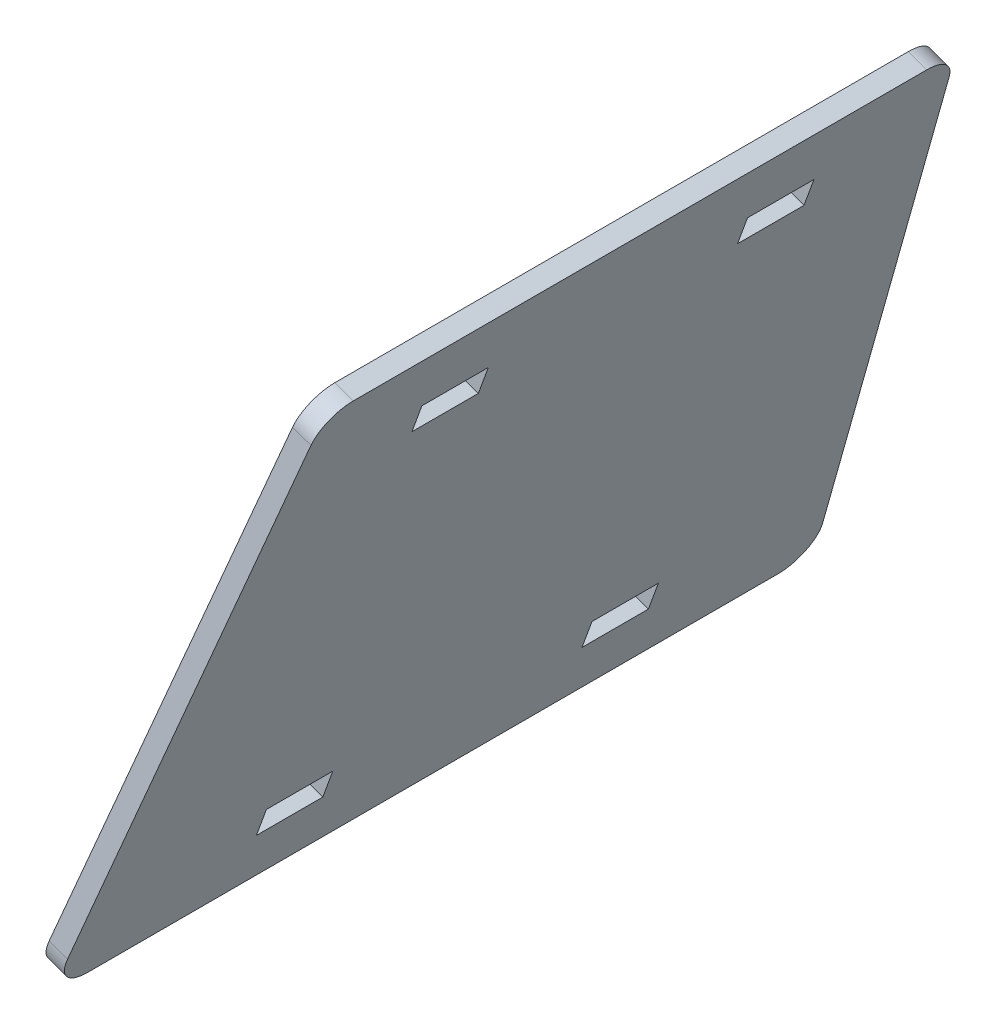
from build123d import *

# Parameters (mm, degrees)
BOSS_EXTRUDE1_DEPTH        = 58
SKETCH3_OUTSIDE_W          = 147.986
SKETCH3_OUTSIDE_H          = 126.948
TAB_AND_SLOT_CONTOUR_DEPTH = 3
MOUNTING_TAB_SLOTS_REACH   = 197.382
SKETCH4_W                  = 10.2
SKETCH4_H                  = 4.48444402


with BuildPart() as part:
    # Sketch1 → Boss-Extrude1 (new, symmetric)
    with BuildSketch(Plane.XY):
        Polygon((-63.840100917, 220.738237129), (-95.659428373, 133.315353441), (-98.478506236, 134.341413871), (-66.659178779, 221.764297559), align=None)
    extrude(amount=BOSS_EXTRUDE1_DEPTH, both=True)

    # Sketch3 outside → tab and slot contour (cut)
    with BuildSketch(Plane(origin=(-130.135207504, 47.365341962, 0), x_dir=(0, 0, 1), z_dir=(-0.9396926207859098, 0.3420201433256651, 0))):
        with Locations((0, 139.075)):
            Rectangle(SKETCH3_OUTSIDE_W, SKETCH3_OUTSIDE_H)
        with BuildLine():
            Line((-44.02892944, 185.59149209), (44.02892944, 185.59149209))
            ThreePointArc((44.02892944, 185.59149209), (47.369183029, 184.312070804), (49, 181.128574477))
            Line((49, 181.128574477), (57.97107056, 98.09508485))
            ThreePointArc((57.97107056, 98.09508485), (56.720578714, 94.217748875), (53, 92.558002463))
            Line((53, 92.558002463), (-53, 92.558002463))
            ThreePointArc((-53, 92.558002463), (-56.720578714, 94.217748875), (-57.97107056, 98.09508485))
            Line((-57.97107056, 98.09508485), (-49, 181.128574477))
            ThreePointArc((-49, 181.128574477), (-47.369183029, 184.312070804), (-44.02892944, 185.59149209))
        make_face(mode=Mode.SUBTRACT)
    extrude(amount=-TAB_AND_SLOT_CONTOUR_DEPTH, mode=Mode.SUBTRACT)

    # Sketch4 → mounting tab slots (cut, up to next)
    with BuildSketch(Plane(origin=(-130.135207504, 47.365341962, 0), x_dir=(0, 0, 1), z_dir=(-0.9396926207859099, 0.3420201433256647, 0)), mode=Mode.PRIVATE) as mounting_tab_slots_sk1:
        with Locations((-25, 173.44927008)):
            Rectangle(SKETCH4_W, SKETCH4_H)
    mounting_tab_slots_tool1 = extrude(mounting_tab_slots_sk1.sketch, amount=-MOUNTING_TAB_SLOTS_REACH, mode=Mode.PRIVATE) & part.part
    # Sketch4 → mounting tab slots (cut, up to next)
    with BuildSketch(Plane(origin=(-130.135207504, 47.365341962, 0), x_dir=(0, 0, 1), z_dir=(-0.9396926207859099, 0.3420201433256647, 0)), mode=Mode.PRIVATE) as mounting_tab_slots_sk2:
        with Locations((-25, 103.608313771)):
            Rectangle(SKETCH4_W, SKETCH4_H)
    mounting_tab_slots_tool2 = extrude(mounting_tab_slots_sk2.sketch, amount=-MOUNTING_TAB_SLOTS_REACH, mode=Mode.PRIVATE) & part.part
    # Sketch4 → mounting tab slots (cut, up to next)
    with BuildSketch(Plane(origin=(-130.135207504, 47.365341962, 0), x_dir=(0, 0, 1), z_dir=(-0.9396926207859099, 0.3420201433256647, 0)), mode=Mode.PRIVATE) as mounting_tab_slots_sk3:
        with Locations((25, 173.44927008)):
            Rectangle(SKETCH4_W, SKETCH4_H)
    mounting_tab_slots_tool3 = extrude(mounting_tab_slots_sk3.sketch, amount=-MOUNTING_TAB_SLOTS_REACH, mode=Mode.PRIVATE) & part.part
    # Sketch4 → mounting tab slots (cut, up to next)
    with BuildSketch(Plane(origin=(-130.135207504, 47.365341962, 0), x_dir=(0, 0, 1), z_dir=(-0.9396926207859099, 0.3420201433256647, 0)), mode=Mode.PRIVATE) as mounting_tab_slots_sk4:
        with Locations((25, 103.608313771)):
            Rectangle(SKETCH4_W, SKETCH4_H)
    mounting_tab_slots_tool4 = extrude(mounting_tab_slots_sk4.sketch, amount=-MOUNTING_TAB_SLOTS_REACH, mode=Mode.PRIVATE) & part.part
    add(mounting_tab_slots_tool1.solids().sort_by_distance((-70.812063, 210.354341, -25))[0], mode=Mode.SUBTRACT)
    add(mounting_tab_slots_tool2.solids().sort_by_distance((-94.699077, 144.72531, -25))[0], mode=Mode.SUBTRACT)
    add(mounting_tab_slots_tool3.solids().sort_by_distance((-70.812063, 210.354341, 25))[0], mode=Mode.SUBTRACT)
    add(mounting_tab_slots_tool4.solids().sort_by_distance((-94.699077, 144.72531, 25))[0], mode=Mode.SUBTRACT)


solid = part.part
